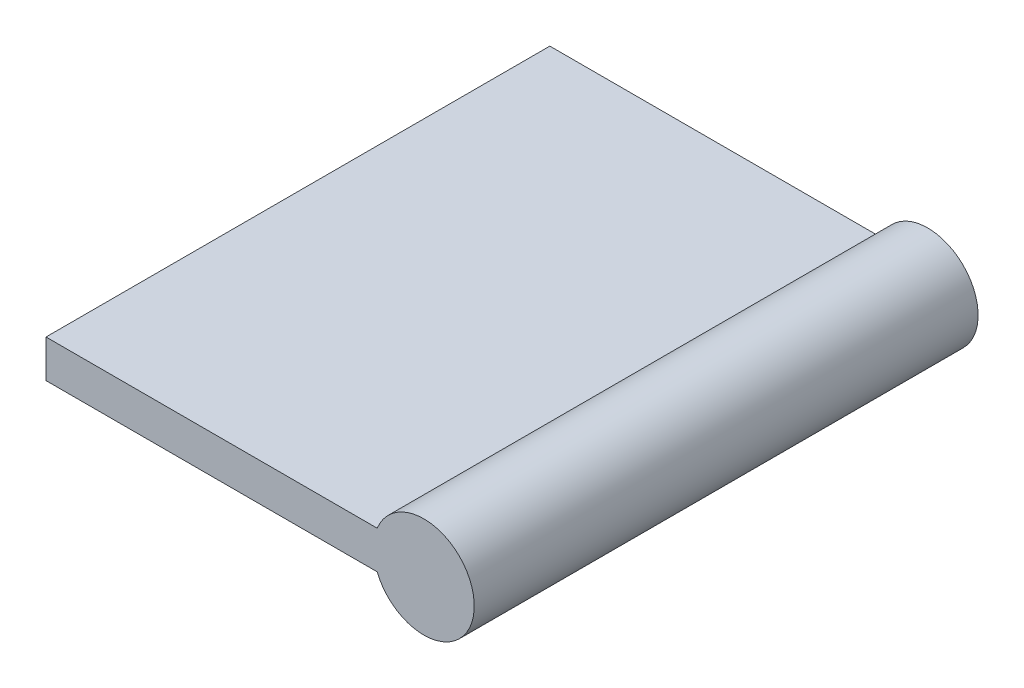
from build123d import *

# Parameters (mm, degrees)
SKETCH1_R           = 2
BOSS_EXTRUDE1_DEPTH = 10
SKETCH2_W           = 20
SKETCH2_H           = 1.5
BOSS_EXTRUDE2_DEPTH = 15


with BuildPart() as part:
    # Sketch1 → Boss-Extrude1 (new, symmetric)
    with BuildSketch(Plane.XY):
        Circle(SKETCH1_R)
    extrude(amount=BOSS_EXTRUDE1_DEPTH, both=True)

    # Sketch2 → Boss-Extrude2 (add)
    with BuildSketch(Plane(origin=(0, 0, 0), x_dir=(0, 0, -1), z_dir=(1, 0, 0))):
        Rectangle(SKETCH2_W, SKETCH2_H)
    extrude(amount=-BOSS_EXTRUDE2_DEPTH)


solid = part.part
